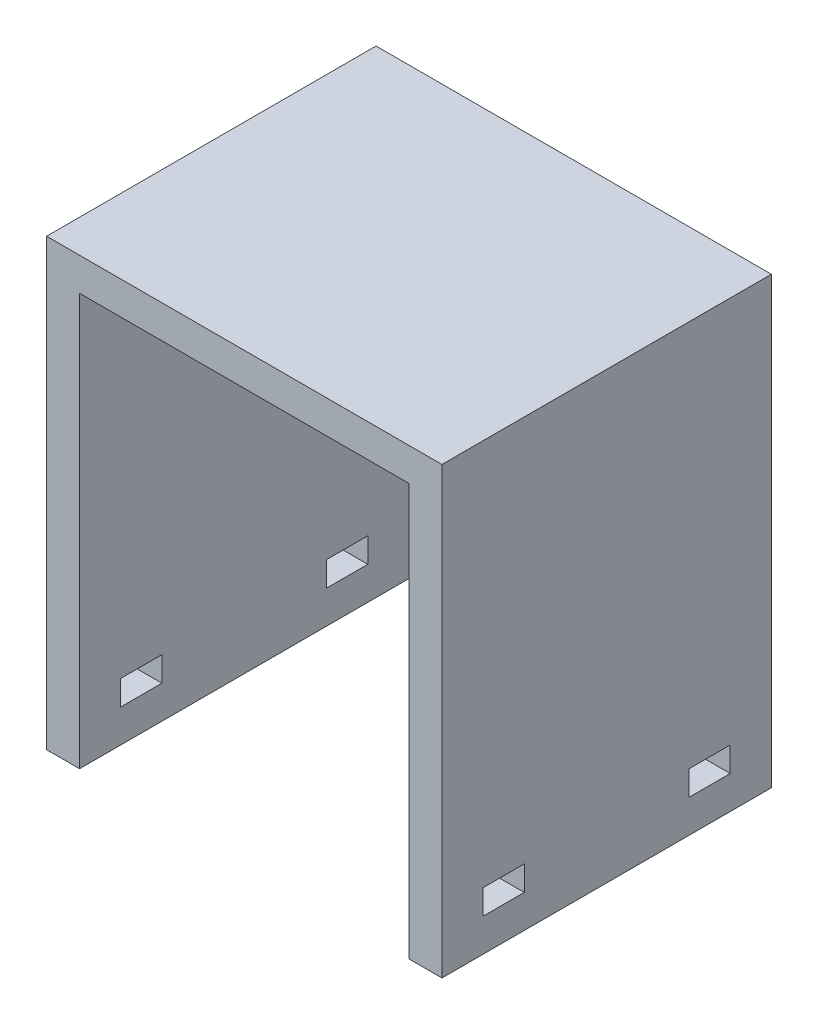
from build123d import *

# Parameters (mm, degrees)
BOSS_EXTRUDE1_DEPTH = 50.8
SKETCH2_W           = 6.35
SKETCH2_H           = 3.81
CUT_EXTRUDE1_DEPTH  = 98.053263727


with BuildPart() as part:
    # Sketch1 → Boss-Extrude1 (new body)
    with BuildSketch(Plane.XY):
        Polygon((55.88, 55.88), (55.88, -12.7), (50.8, -12.7), (50.8, 50.8), (0, 50.8), (0, -12.7), (-5.08, -12.7), (-5.08, 55.88), align=None)
    extrude(amount=BOSS_EXTRUDE1_DEPTH)

    # Sketch2 → Cut-Extrude1 (cut, through all)
    with BuildSketch(Plane.ZY.offset(5.08)):
        with Locations((9.525, -5.715)):
            Rectangle(SKETCH2_W, SKETCH2_H)
        with Locations((41.275, -5.715)):
            Rectangle(SKETCH2_W, SKETCH2_H)
    extrude(amount=-CUT_EXTRUDE1_DEPTH, mode=Mode.SUBTRACT)


solid = part.part
